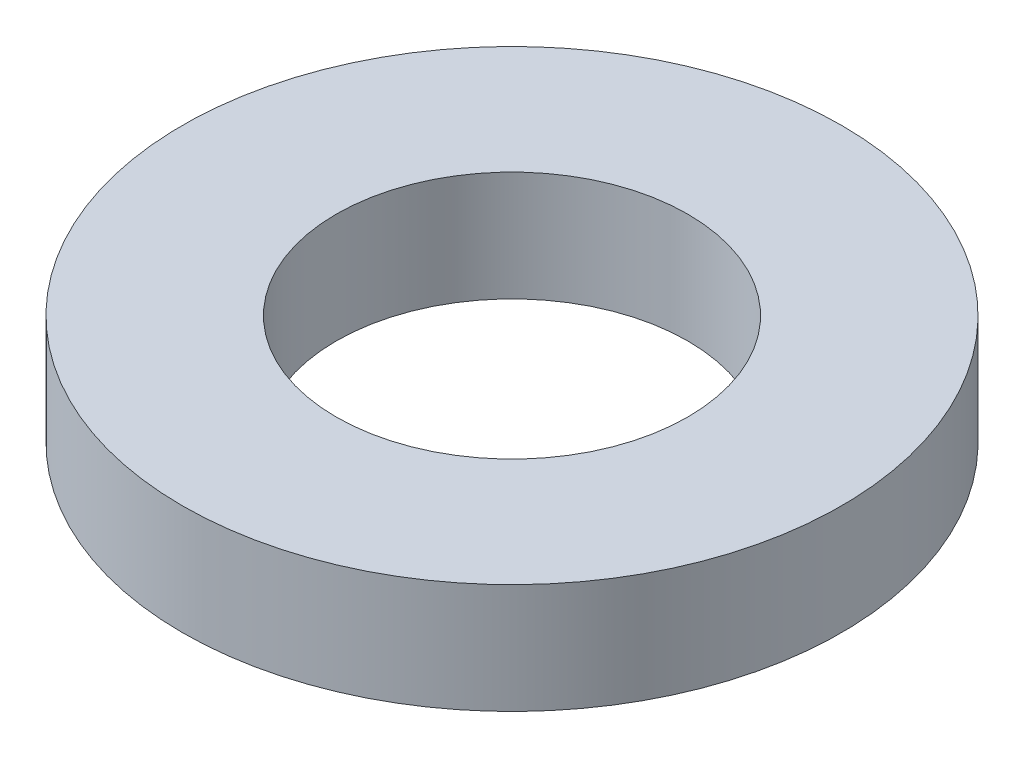
from build123d import *

# Parameters (mm, degrees)
SKETCH1_R           = 4.7625
SKETCH1_R_2         = 2.54
BOSS_EXTRUDE1_DEPTH = 1.5875


with BuildPart() as part:
    # Sketch1 → Boss-Extrude1 (new body)
    with BuildSketch(Plane(origin=(0, 0, 0), x_dir=(1, 0, 0), z_dir=(0, 1, 0))):
        with Locations(Location((0, 0, 0), (0, 0, 270))):
            Circle(SKETCH1_R)
        with Locations(Location((0, 0, 0), (0, 0, 270))):
            Circle(SKETCH1_R_2, mode=Mode.SUBTRACT)
    extrude(amount=BOSS_EXTRUDE1_DEPTH)


solid = part.part
